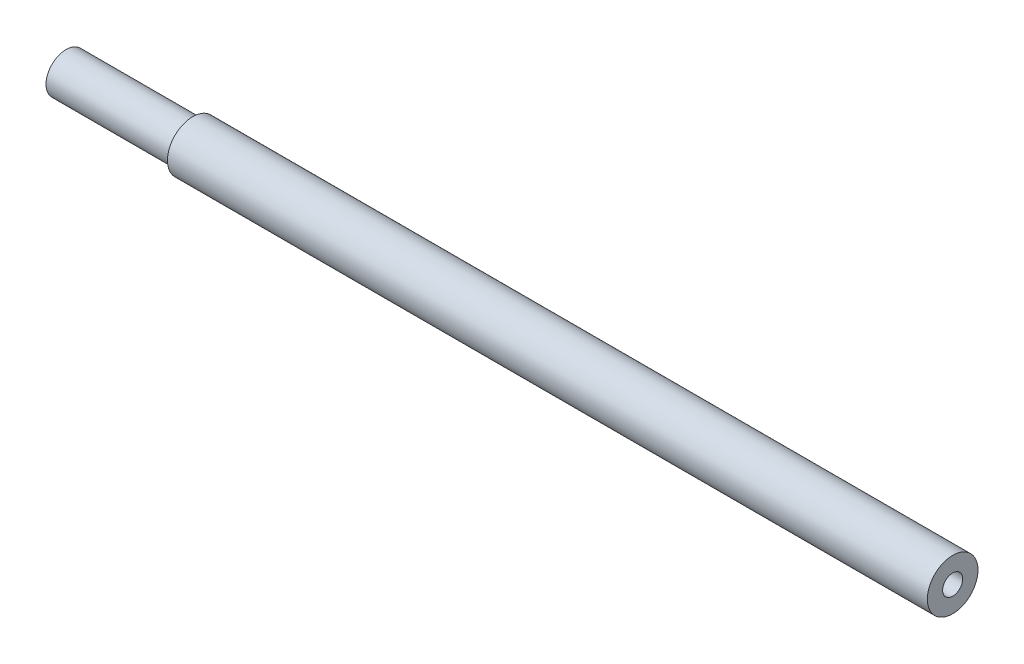
from build123d import *

# Parameters (mm, degrees)
SKETCH1_R           = 2
BOSS_EXTRUDE1_DEPTH = 30
SKETCH2_R           = 0.795
CUT_EXTRUDE1_DEPTH  = 7
SKETCH3_R           = 1.5875
BOSS_EXTRUDE2_DEPTH = 10


with BuildPart() as part:
    # Sketch1 → Boss-Extrude1 (new, symmetric)
    with BuildSketch(Plane(origin=(0, 0, 0), x_dir=(0, 0, -1), z_dir=(1, 0, 0))):
        Circle(SKETCH1_R)
    extrude(amount=BOSS_EXTRUDE1_DEPTH, both=True)

    # Sketch2 → Cut-Extrude1 (cut)
    with BuildSketch(Plane(origin=(30, 0, 0), x_dir=(0, 0, -1), z_dir=(1, 0, 0))):
        Circle(SKETCH2_R)
    extrude(amount=-CUT_EXTRUDE1_DEPTH, mode=Mode.SUBTRACT)

    # Sketch3 → Boss-Extrude2 (add)
    with BuildSketch(Plane.ZY.offset(30)):
        with Locations(Location((0, 0, 0), (0, 0, 180))):
            Circle(SKETCH3_R)
    extrude(amount=BOSS_EXTRUDE2_DEPTH)


solid = part.part
